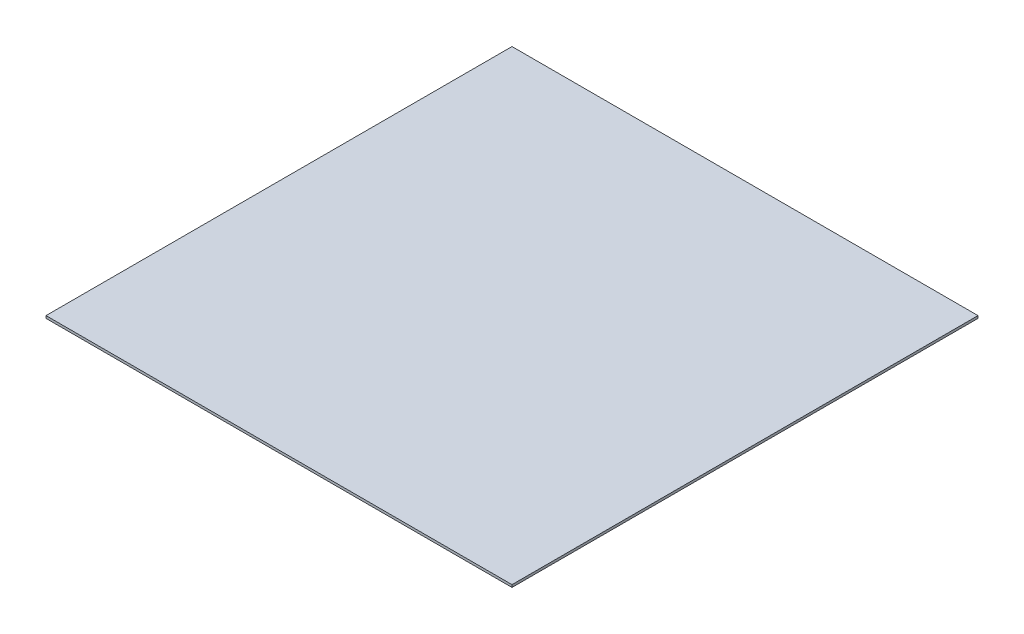
from build123d import *

# Parameters (mm, degrees)
SKETCH1_W           = 289.56
SKETCH1_H           = 289.56
BOSS_EXTRUDE1_DEPTH = 1.524


with BuildPart() as part:
    # Sketch1 → Boss-Extrude1 (new body)
    with BuildSketch(Plane(origin=(0, 0, 0), x_dir=(1, 0, 0), z_dir=(0, 1, 0))):
        Rectangle(SKETCH1_W, SKETCH1_H)
    extrude(amount=BOSS_EXTRUDE1_DEPTH)


solid = part.part
